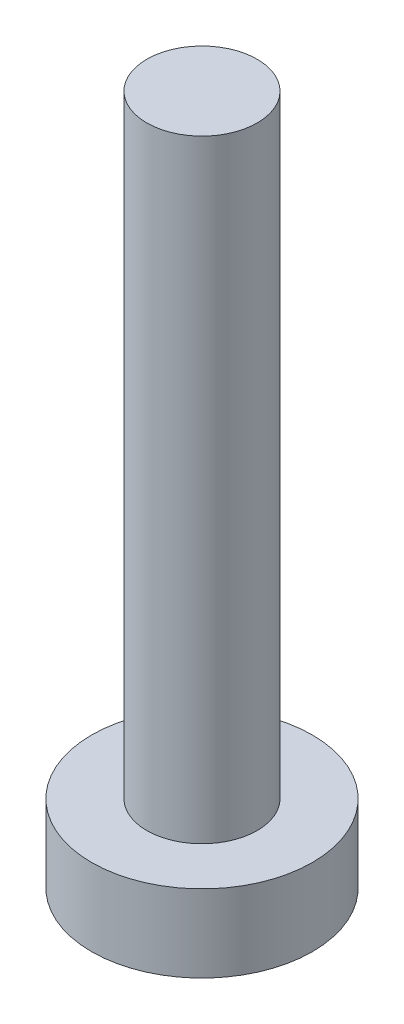
from build123d import *

# Parameters (mm, degrees)
SKETCH_1_R      = 4
SKETCH_1_R_2    = 2
EXTRUDE_1_DEPTH = 2.8
SKETCH_1_4_R    = 2
EXTRUDE_3_DEPTH = 25


with BuildPart() as part:
    # 草图1 → 凸台-拉伸1 (new body)
    with BuildSketch(Plane(origin=(0, 0, 0), x_dir=(1, 0, 0), z_dir=(0, 1, 0))):
        Circle(SKETCH_1_R)
        Circle(SKETCH_1_R_2, mode=Mode.SUBTRACT)
    extrude(amount=EXTRUDE_1_DEPTH)

    # 草图1<4> → 凸台-拉伸3 (add)
    with BuildSketch(Plane(origin=(0, 0, 0), x_dir=(1, 0, 0), z_dir=(0, 1, 0))):
        Circle(SKETCH_1_4_R)
    extrude(amount=EXTRUDE_3_DEPTH)


solid = part.part
